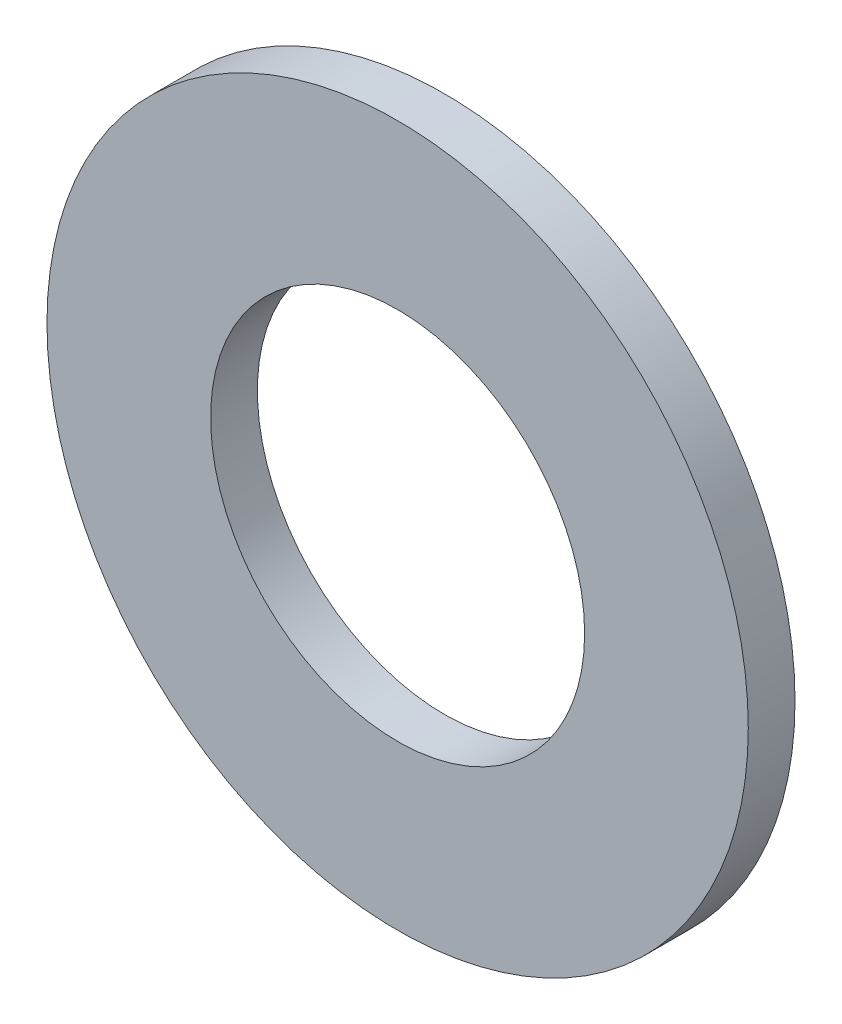
from build123d import *

# Parameters (mm, degrees)
ESQUISSE1_R      = 3
ESQUISSE1_R_2    = 1.6
EXTRUSION1_DEPTH = 0.4


with BuildPart() as part:
    # Esquisse1 → Extrusion1 (new body)
    with BuildSketch(Plane.XY):
        Circle(ESQUISSE1_R)
        Circle(ESQUISSE1_R_2, mode=Mode.SUBTRACT)
    extrude(amount=EXTRUSION1_DEPTH)


solid = part.part
